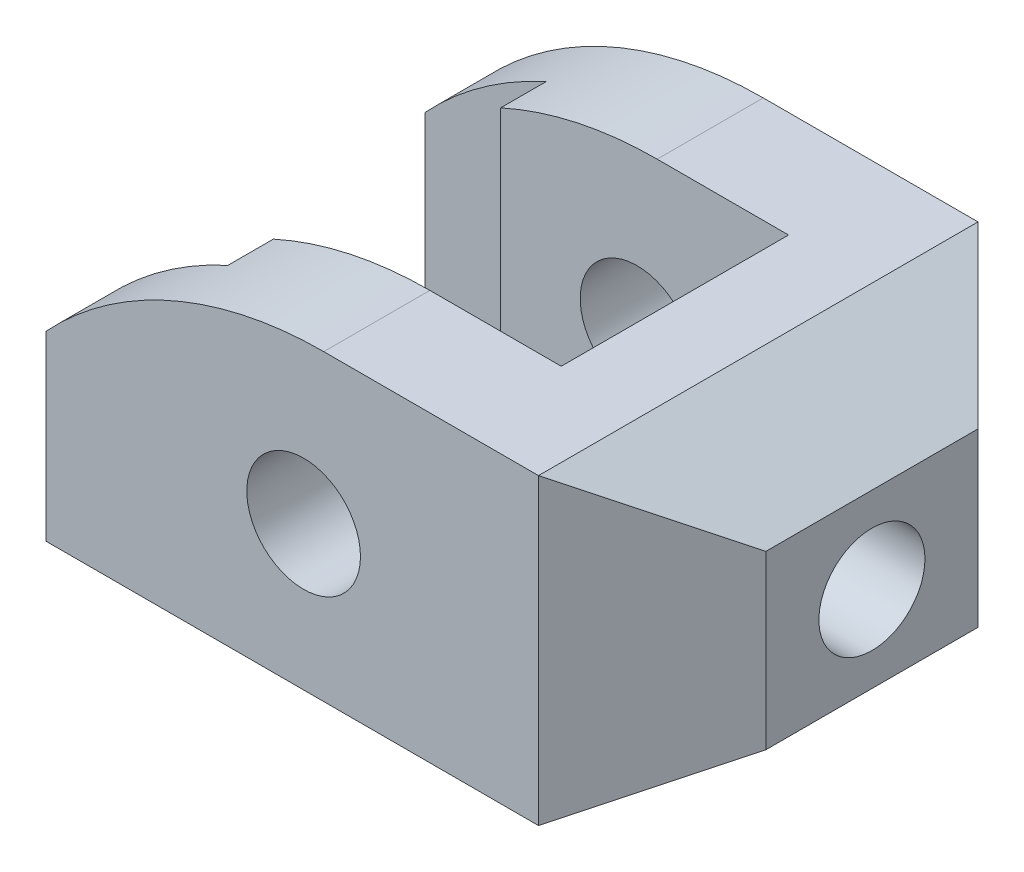
from build123d import *

# Parameters (mm, degrees)
SKETCH1_W           = 80
SKETCH1_H           = 58
BOSS_EXTRUDE1_DEPTH = 40
SKETCH2_R           = 7.5
CUT_EXTRUDE1_DEPTH  = 95
CUT_EXTRUDE4_DEPTH  = 95
SKETCH7_W           = 36.66060556
SKETCH7_H           = 15
SKETCH7_W_2         = 17.33939444
CUT_EXTRUDE5_DEPTH  = 95
SKETCH8_W           = 16
SKETCH8_H           = 42
CUT_EXTRUDE6_DEPTH  = 95
SKETCH9_R           = 7
CUT_EXTRUDE7_DEPTH  = 95


with BuildPart() as part:
    # Sketch1 → Boss-Extrude1 (new body)
    with BuildSketch(Plane(origin=(0, 0, 0), x_dir=(1, 0, 0), z_dir=(0, 1, 0))):
        Rectangle(SKETCH1_W, SKETCH1_H)
    extrude(amount=BOSS_EXTRUDE1_DEPTH)

    # Sketch2 → Cut-Extrude1 (cut)
    with BuildSketch(Plane.XY.offset(29)):
        with Locations((-6, 19)):
            Circle(SKETCH2_R)
        Polygon((25, 0), (40, 0), (40, 8.660254038), align=None)
        Polygon((25, 40), (40, 40), (40, 31.339745962), align=None)
    extrude(amount=-CUT_EXTRUDE1_DEPTH, mode=Mode.SUBTRACT)

    # Sketch4 → Cut-Extrude4 (cut)
    with BuildSketch(Plane.XY.offset(29)):
        with BuildLine():
            ThreePointArc((-40, 24), (-23.33939444, 35.82575695), (-3.33939444, 40))
            Line((-3.33939444, 40), (-40, 40))
            Line((-40, 40), (-40, 24))
        make_face()
    extrude(amount=-CUT_EXTRUDE4_DEPTH, mode=Mode.SUBTRACT)

    # Sketch7 → Cut-Extrude5 (cut)
    with BuildSketch(Plane(origin=(0, 40, 0), x_dir=(1, 0, 0), z_dir=(0, 1, 0))):
        with Locations((-21.66969722, -7.5)):
            Rectangle(SKETCH7_W, SKETCH7_H)
        with Locations((-21.66969722, 7.5)):
            Rectangle(SKETCH7_W, SKETCH7_H)
        with Locations((5.33030278, 7.5)):
            Rectangle(SKETCH7_W_2, SKETCH7_H)
        with Locations((5.33030278, -7.5)):
            Rectangle(SKETCH7_W_2, SKETCH7_H)
        Polygon((40, 14), (40, 29), (25, 29), align=None)
        Polygon((40, -29), (25, -29), (40, -14), align=None)
    extrude(amount=-CUT_EXTRUDE5_DEPTH, mode=Mode.SUBTRACT)

    # Sketch8 → Cut-Extrude6 (cut)
    with BuildSketch(Plane(origin=(0, 40, 0), x_dir=(1, 0, 0), z_dir=(0, 1, 0))):
        with Locations((-32, 0)):
            Rectangle(SKETCH8_W, SKETCH8_H)
    extrude(amount=-CUT_EXTRUDE6_DEPTH, mode=Mode.SUBTRACT)

    # Sketch9 → Cut-Extrude7 (cut)
    with BuildSketch(Plane(origin=(40, 0, 0), x_dir=(0, 0, -1), z_dir=(1, 0, 0))):
        with Locations((0, 20)):
            Circle(SKETCH9_R)
    extrude(amount=-CUT_EXTRUDE7_DEPTH, mode=Mode.SUBTRACT)


solid = part.part
